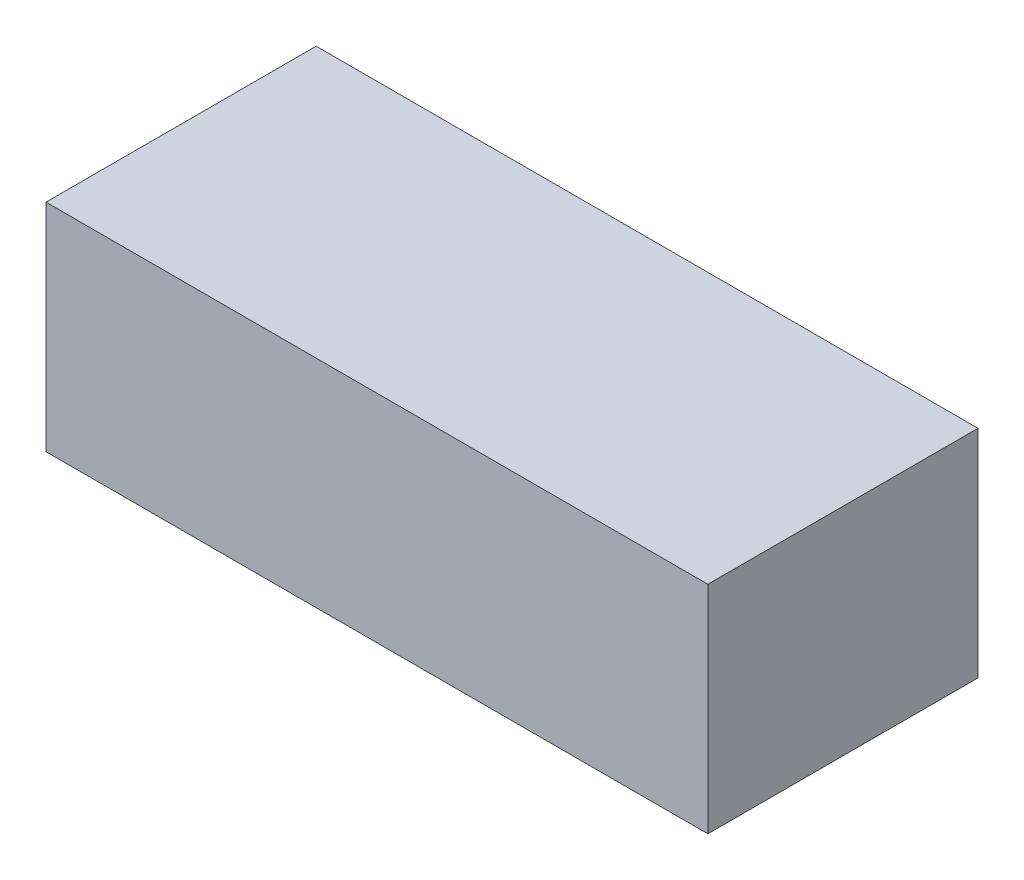
from build123d import *

# Parameters (mm, degrees)
SKETCH1_W           = 12.25
SKETCH1_H           = 4
BOSS_EXTRUDE1_DEPTH = 5


with BuildPart() as part:
    # Sketch1 → Boss-Extrude1 (new body)
    with BuildSketch(Plane.XY):
        with Locations((-1.49001147, 14.126635049)):
            Rectangle(SKETCH1_W, SKETCH1_H)
    extrude(amount=BOSS_EXTRUDE1_DEPTH)


solid = part.part
